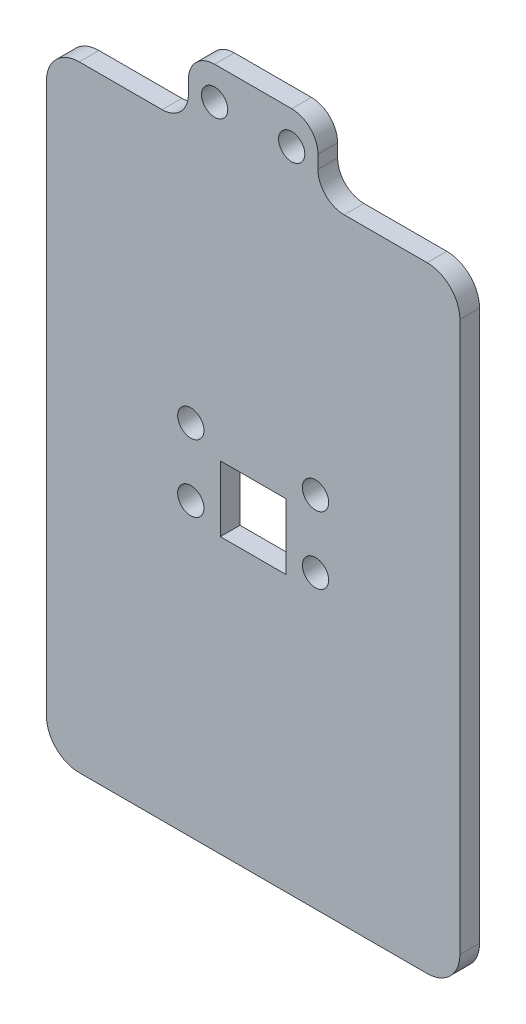
from build123d import *

# Parameters (mm, degrees)
SKETCH_1_R      = 2
SKETCH_1_W      = 10
SKETCH_1_H      = 10
EXTRUDE_1_DEPTH = 3


with BuildPart() as part:
    # Эскиз1 → Бобышка-Вытянуть1 (new body)
    with BuildSketch(Plane.XY):
        with BuildLine():
            Line((13.869679809, 46.9), (26.5, 46.9))
            ThreePointArc((26.5, 46.9), (30.035533906, 45.435533906), (31.5, 41.9))
            Line((31.5, 41.9), (31.5, -41.9))
            ThreePointArc((31.5, -41.9), (30.035533906, -45.435533906), (26.5, -46.9))
            Line((26.5, -46.9), (-26.5, -46.9))
            ThreePointArc((-26.5, -46.9), (-30.035533906, -45.435533906), (-31.5, -41.9))
            Line((-31.5, -41.9), (-31.5, 41.9))
            ThreePointArc((-31.5, 41.9), (-30.035533906, 45.435533906), (-26.5, 46.9))
            Line((-26.5, 46.9), (-13.869679809, 46.9))
            ThreePointArc((-13.869679809, 46.9), (-11.041252684, 48.071572875), (-9.869679809, 50.9))
            Line((-9.869679809, 50.9), (-9.869679809, 52.9))
            ThreePointArc((-9.869679809, 52.9), (-8.698106934, 55.728427125), (-5.869679809, 56.9))
            Line((-5.869679809, 56.9), (5.869679809, 56.9))
            ThreePointArc((5.869679809, 56.9), (8.698106934, 55.728427125), (9.869679809, 52.9))
            Line((9.869679809, 52.9), (9.869679809, 50.9))
            ThreePointArc((9.869679809, 50.9), (11.041252684, 48.071572875), (13.869679809, 46.9))
        make_face()
        with Locations((-5.869679809, 51.9)):
            Circle(SKETCH_1_R, mode=Mode.SUBTRACT)
        with Locations((5.869679809, 51.9)):
            Circle(SKETCH_1_R, mode=Mode.SUBTRACT)
        with Locations((9.5, -2.5)):
            Circle(SKETCH_1_R, mode=Mode.SUBTRACT)
        with Locations((-9.5, -2.5)):
            Circle(SKETCH_1_R, mode=Mode.SUBTRACT)
        with Locations((-9.5, 7.75)):
            Circle(SKETCH_1_R, mode=Mode.SUBTRACT)
        with Locations((9.5, 7.75)):
            Circle(SKETCH_1_R, mode=Mode.SUBTRACT)
        Rectangle(SKETCH_1_W, SKETCH_1_H, mode=Mode.SUBTRACT)
    extrude(amount=EXTRUDE_1_DEPTH)


solid = part.part
